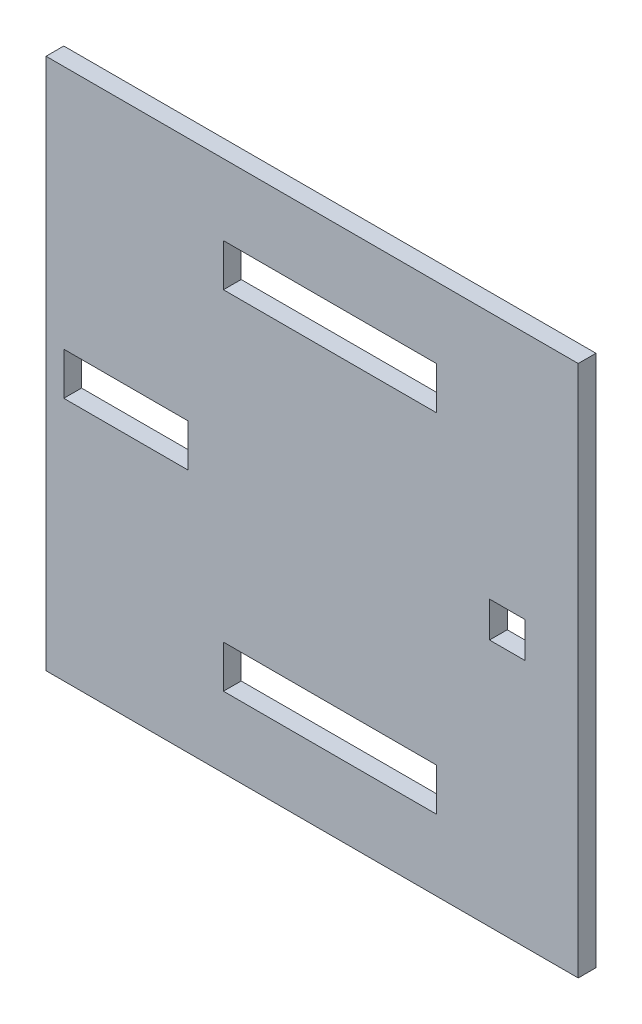
from build123d import *

# Parameters (mm, degrees)
ESQUISSE2_W             = 150
ESQUISSE2_H             = 150
BOSS_EXTRU_1_DEPTH      = 5
ESQUISSE3_W             = 60
ESQUISSE3_H             = 12
ESQUISSE3_W_2           = 35
ENL_V_MAT_EXTRU_3_DEPTH = 107.183802908
ESQUISSE4_W             = 10
ESQUISSE4_H             = 10
ENL_V_MAT_EXTRU_4_DEPTH = 10


with BuildPart() as part:
    # Esquisse2 → Boss.-Extru.1 (new body)
    with BuildSketch(Plane.XY):
        Rectangle(ESQUISSE2_W, ESQUISSE2_H)
    extrude(amount=BOSS_EXTRU_1_DEPTH)

    # Esquisse3 → Enlèv. mat.-Extru.3 (cut, through all)
    with BuildSketch(Plane.XY.offset(5)):
        with Locations((5, 49)):
            Rectangle(ESQUISSE3_W, ESQUISSE3_H)
        with Locations((5, -49)):
            Rectangle(ESQUISSE3_W, ESQUISSE3_H)
        with Locations((-52.5, 0)):
            Rectangle(ESQUISSE3_W_2, ESQUISSE3_H)
    extrude(amount=-ENL_V_MAT_EXTRU_3_DEPTH, mode=Mode.SUBTRACT)

    # Esquisse4 → Enlèv. mat.-Extru.4 (cut)
    with BuildSketch(Plane.XY.offset(5)):
        with Locations((55, 0)):
            Rectangle(ESQUISSE4_W, ESQUISSE4_H)
    extrude(amount=-ENL_V_MAT_EXTRU_4_DEPTH, mode=Mode.SUBTRACT)


solid = part.part
